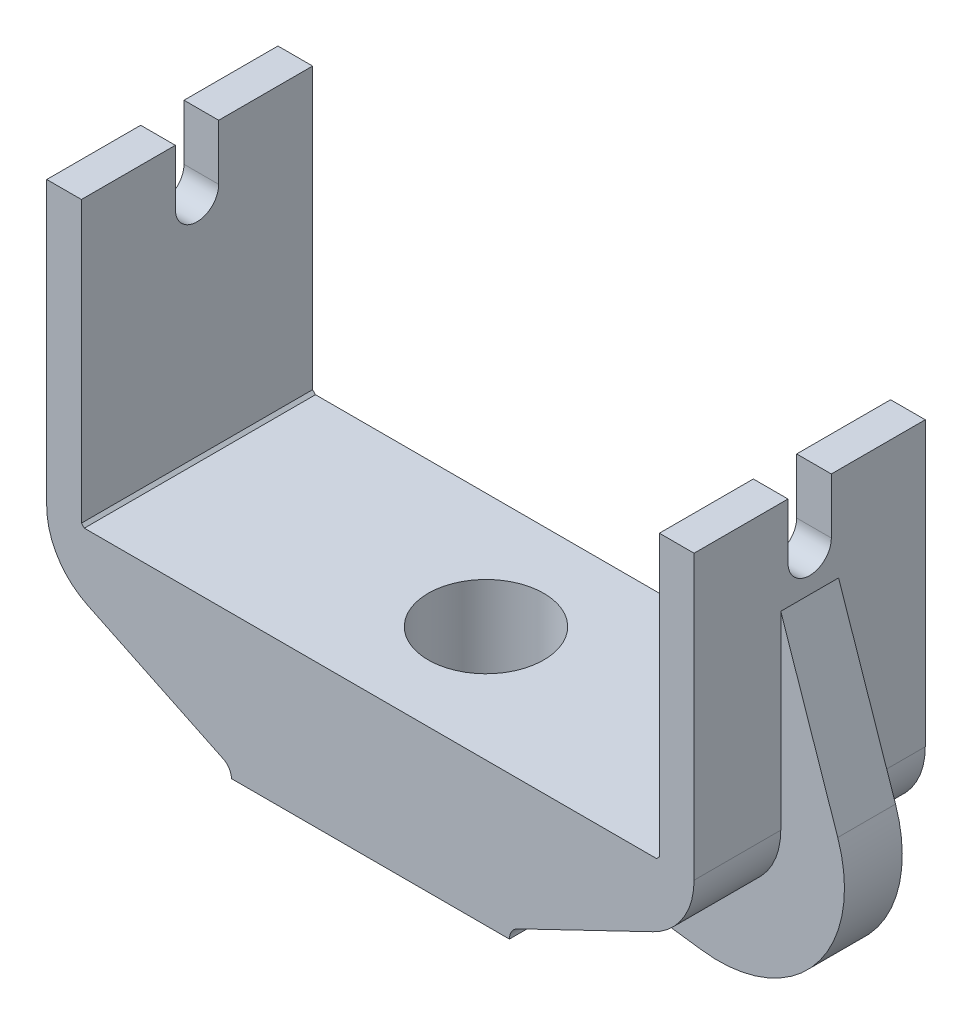
from build123d import *

# Parameters (mm, degrees)
BOSS_EXTRUDE1_DEPTH = 2
CHAMFER1_SIZE       = 0.05
BOSS_EXTRUDE2_DEPTH = 0.5
CUT_EXTRUDE1_DEPTH  = 15.484682492
SKETCH5_R           = 1
CUT_EXTRUDE2_DEPTH  = 9.539796483


with BuildPart() as part:
    # Sketch1 → Boss-Extrude1 (new, symmetric)
    with BuildSketch(Plane.XY):
        with BuildLine():
            Line((0, 0), (2.405, 0))
            ThreePointArc((2.405, 0), (2.443345275, 0.133049905), (2.546618218, 0.225285129))
            Line((2.546618218, 0.225285129), (4.891908909, 1.353574355))
            ThreePointArc((4.891908909, 1.353574355), (5.408273626, 1.814750474), (5.6, 2.48))
            Line((5.6, 2.48), (5.6, 7.38))
            Line((5.6, 7.38), (5, 7.38))
            Line((5, 7.38), (5, 2.48))
            Line((5, 2.48), (0, 2.48))
            Line((0, 2.48), (0, 0))
        make_face()
    boss_extrude1 = extrude(amount=BOSS_EXTRUDE1_DEPTH, both=True)

    # Mirror1: Boss-Extrude1 across plane
    add(boss_extrude1.mirror(Plane(origin=(0, 0, 0), x_dir=(0, 0, 1), z_dir=(1, 0, 0))))

    # Chamfer1
    chamfer1_edges = [part.edges().sort_by_distance(p)[0] for p in [
        (5, 2.48, 0),
        (-5, 2.48, 0),
    ]]
    chamfer(chamfer1_edges, length=CHAMFER1_SIZE)

    # Sketch3 → Boss-Extrude2 (add, symmetric)
    with BuildSketch(Plane.XY):
        with BuildLine():
            Line((2.546618218, 0.225285129), (4.233522805, 0))
            ThreePointArc((4.233522805, 0), (6.206510258, 0.776923649), (6.585860055, 2.863160351))
            Line((6.585860055, 2.863160351), (5.6, 5.76))
            Line((5.6, 5.76), (5.6, 2.48))
            ThreePointArc((5.6, 2.48), (5.408273626, 1.814750474), (4.891908909, 1.353574355))
            Line((4.891908909, 1.353574355), (2.546618218, 0.225285129))
        make_face()
    boss_extrude2 = extrude(amount=BOSS_EXTRUDE2_DEPTH, both=True)

    # Mirror2: Boss-Extrude2 across plane
    add(boss_extrude2.mirror(Plane(origin=(0, 0, 0), x_dir=(0, 0, 1), z_dir=(1, 0, 0))))

    # Sketch4 → Cut-Extrude1 (cut, through all)
    with BuildSketch(Plane(origin=(5.6, 0, 0), x_dir=(0, 0, -1), z_dir=(1, 0, 0))):
        with BuildLine():
            Line((0.375, 6.42), (0.375, 7.38))
            Line((0.375, 7.38), (-0.375, 7.38))
            Line((-0.375, 7.38), (-0.375, 6.42))
            ThreePointArc((-0.375, 6.42), (0, 6.045), (0.375, 6.42))
        make_face()
    extrude(amount=-CUT_EXTRUDE1_DEPTH, mode=Mode.SUBTRACT)

    # Sketch5 → Cut-Extrude2 (cut, through all)
    with BuildSketch(Plane(origin=(0, 2.48, 0), x_dir=(1, 0, 0), z_dir=(0, 1, 0))):
        with Locations(Location((0, 0, 0), (0, 0, 180))):
            Circle(SKETCH5_R)
    extrude(amount=-CUT_EXTRUDE2_DEPTH, mode=Mode.SUBTRACT)


solid = part.part
